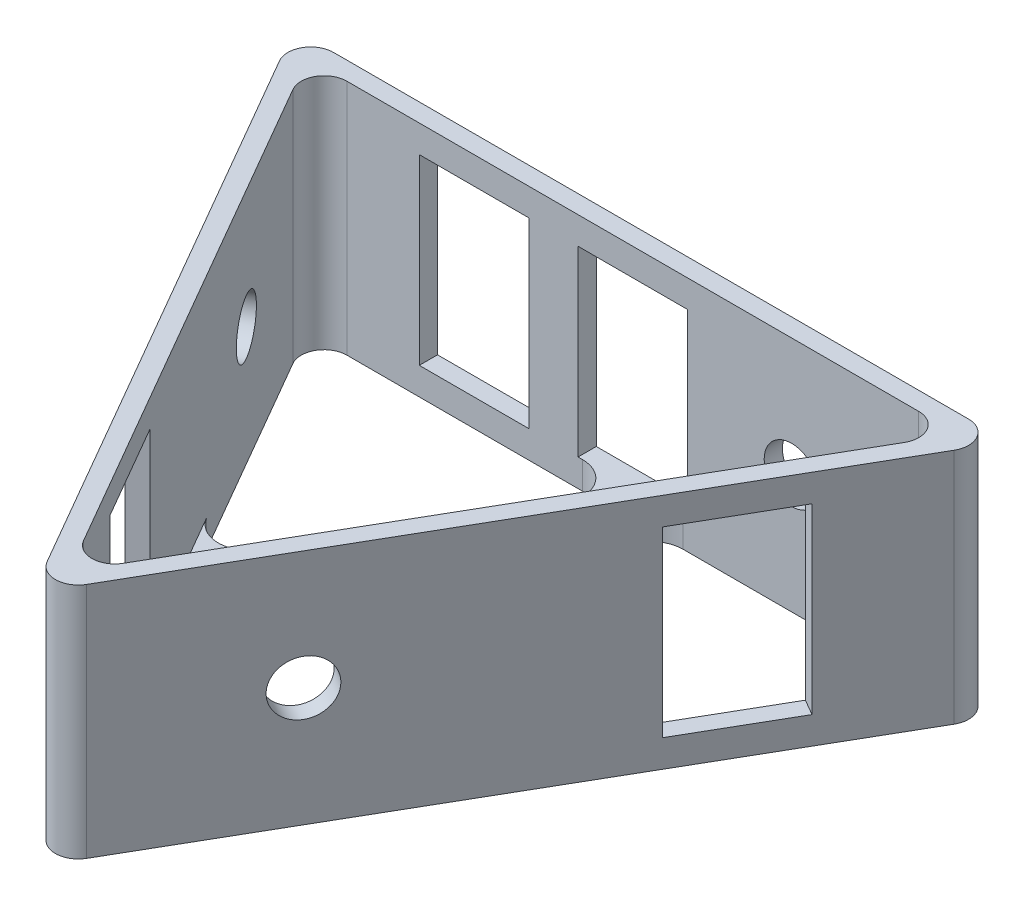
from build123d import *

# Parameters (mm, degrees)
BOSS_EXTRUDE1_DEPTH = 26
FILLET1_R           = 2.5
CUT_EXTRUDE1_REACH  = 76.051
SKETCH2_R           = 3
CUT_EXTRUDE2_REACH  = 73.261
SKETCH3_R           = 3
CUT_EXTRUDE3_REACH  = 90.154
SKETCH4_R           = 3
SKETCH4_W           = 12
SKETCH4_H           = 20
BOSS_EXTRUDE2_DEPTH = 3
FILLET2_R           = 3.5


with BuildPart() as part:
    # Sketch1 → Boss-Extrude1 (new body)
    with BuildSketch(Plane(origin=(0, 0, 0), x_dir=(1, 0, 0), z_dir=(0, 1, 0))):
        Polygon((-55.080799194, 36.198206666), (23.167912006, 36.198206666), (-15.956443594, -31.567165046), align=None)
        Polygon((-51.616697579, 34.198206666), (19.703810391, 34.198206666), (-15.956443594, -27.567165046), align=None, mode=Mode.SUBTRACT)
    extrude(amount=BOSS_EXTRUDE1_DEPTH)

    # Fillet1
    fillet1_edges = [part.edges().sort_by_distance(p)[0] for p in [
        (-51.616697579, 13, -34.198206666),
        (-15.956443594, 13, 27.567165046),
        (19.703810391, 13, -34.198206666),
        (-55.080799194, 13, -36.198206666),
        (23.167912006, 13, -36.198206666),
        (-15.956443594, 13, 31.567165046),
    ]]
    fillet(fillet1_edges, radius=FILLET1_R)

    # Sketch2 → Cut-Extrude1 (cut, up to next)
    with BuildSketch(Plane(origin=(-25.636316123, 0, 14.801134015), x_dir=(0.49999999999999806, 0, 0.8660254037844397), z_dir=(-0.8660254037844397, 0, 0.49999999999999806)), mode=Mode.PRIVATE) as cut_extrude1_sk1:
        Polygon((3.632503749, 4.258248906), (-8.367496251, 8.741751094), (-8.367496251, 3), (3.632503749, 3), align=None)
    cut_extrude1_tool1 = extrude(cut_extrude1_sk1.sketch, amount=-CUT_EXTRUDE1_REACH, mode=Mode.PRIVATE) & part.part
    # Sketch2 → Cut-Extrude1 (cut, up to next)
    with BuildSketch(Plane(origin=(-25.636316123, 0, 14.801134015), x_dir=(0.49999999999999806, 0, 0.8660254037844397), z_dir=(-0.8660254037844397, 0, 0.49999999999999806)), mode=Mode.PRIVATE) as cut_extrude1_sk2:
        Polygon((-8.367496251, 13), (-8.367496251, 8.741751094), (3.632503749, 4.258248906), (3.632503749, 13), align=None)
    cut_extrude1_tool2 = extrude(cut_extrude1_sk2.sketch, amount=-CUT_EXTRUDE1_REACH, mode=Mode.PRIVATE) & part.part
    # Sketch2 → Cut-Extrude1 (cut, up to next)
    with BuildSketch(Plane(origin=(-25.636316123, 0, 14.801134015), x_dir=(0.49999999999999806, 0, 0.8660254037844397), z_dir=(-0.8660254037844397, 0, 0.49999999999999806)), mode=Mode.PRIVATE) as cut_extrude1_sk3:
        Polygon((3.632503749, 21.741751094), (-8.367496251, 17.258248906), (-8.367496251, 13), (3.632503749, 13), align=None)
    cut_extrude1_tool3 = extrude(cut_extrude1_sk3.sketch, amount=-CUT_EXTRUDE1_REACH, mode=Mode.PRIVATE) & part.part
    # Sketch2 → Cut-Extrude1 (cut, up to next)
    with BuildSketch(Plane(origin=(-25.636316123, 0, 14.801134015), x_dir=(0.49999999999999806, 0, 0.8660254037844397), z_dir=(-0.8660254037844397, 0, 0.49999999999999806)), mode=Mode.PRIVATE) as cut_extrude1_sk4:
        Polygon((-8.367496251, 23), (-8.367496251, 17.258248906), (3.632503749, 21.741751094), (3.632503749, 23), align=None)
    cut_extrude1_tool4 = extrude(cut_extrude1_sk4.sketch, amount=-CUT_EXTRUDE1_REACH, mode=Mode.PRIVATE) & part.part
    # Sketch2 → Cut-Extrude1 (cut, up to next)
    with BuildSketch(Plane(origin=(-25.636316123, 0, 14.801134015), x_dir=(0.49999999999999806, 0, 0.8660254037844397), z_dir=(-0.8660254037844397, 0, 0.49999999999999806)), mode=Mode.PRIVATE) as cut_extrude1_sk5:
        with Locations((-37.161724832, 13)):
            Circle(SKETCH2_R)
    cut_extrude1_tool5 = extrude(cut_extrude1_sk5.sketch, amount=-CUT_EXTRUDE1_REACH, mode=Mode.PRIVATE) & part.part
    add(cut_extrude1_tool1.solids().sort_by_distance((-27.460565, 4.989307, 11.641443))[0], mode=Mode.SUBTRACT)
    add(cut_extrude1_tool2.solids().sort_by_distance((-26.475179, 9.621142, 13.34818))[0], mode=Mode.SUBTRACT)
    add(cut_extrude1_tool3.solids().sort_by_distance((-26.475179, 16.378858, 13.34818))[0], mode=Mode.SUBTRACT)
    add(cut_extrude1_tool4.solids().sort_by_distance((-27.460565, 21.010693, 11.641443))[0], mode=Mode.SUBTRACT)
    add(cut_extrude1_tool5.solids().sort_by_distance((-44.217179, 13, -17.381864))[0], mode=Mode.SUBTRACT)

    # Sketch3 → Cut-Extrude2 (cut, up to next)
    with BuildSketch(Plane(origin=(1.701650732, 0, 0.982448508), x_dir=(0.5000000000000041, 0, -0.8660254037844364), z_dir=(0.8660254037844364, 0, 0.5000000000000041)), mode=Mode.PRIVATE) as cut_extrude2_sk1:
        Polygon((15.205281238, 13), (15.205281238, 8.741751094), (27.205281238, 4.258248906), (27.205281238, 13), align=None)
    cut_extrude2_tool1 = extrude(cut_extrude2_sk1.sketch, amount=-CUT_EXTRUDE2_REACH, mode=Mode.PRIVATE) & part.part
    # Sketch3 → Cut-Extrude2 (cut, up to next)
    with BuildSketch(Plane(origin=(1.701650732, 0, 0.982448508), x_dir=(0.5000000000000041, 0, -0.8660254037844364), z_dir=(0.8660254037844364, 0, 0.5000000000000041)), mode=Mode.PRIVATE) as cut_extrude2_sk2:
        Polygon((27.205281238, 4.258248906), (15.205281238, 8.741751094), (15.205281238, 3), (27.205281238, 3), align=None)
    cut_extrude2_tool2 = extrude(cut_extrude2_sk2.sketch, amount=-CUT_EXTRUDE2_REACH, mode=Mode.PRIVATE) & part.part
    # Sketch3 → Cut-Extrude2 (cut, up to next)
    with BuildSketch(Plane(origin=(1.701650732, 0, 0.982448508), x_dir=(0.5000000000000041, 0, -0.8660254037844364), z_dir=(0.8660254037844364, 0, 0.5000000000000041)), mode=Mode.PRIVATE) as cut_extrude2_sk3:
        Polygon((27.205281238, 21.741751094), (15.205281238, 17.258248906), (15.205281238, 13), (27.205281238, 13), align=None)
    cut_extrude2_tool3 = extrude(cut_extrude2_sk3.sketch, amount=-CUT_EXTRUDE2_REACH, mode=Mode.PRIVATE) & part.part
    # Sketch3 → Cut-Extrude2 (cut, up to next)
    with BuildSketch(Plane(origin=(1.701650732, 0, 0.982448508), x_dir=(0.5000000000000041, 0, -0.8660254037844364), z_dir=(0.8660254037844364, 0, 0.5000000000000041)), mode=Mode.PRIVATE) as cut_extrude2_sk4:
        Polygon((15.205281238, 23), (15.205281238, 17.258248906), (27.205281238, 21.741751094), (27.205281238, 23), align=None)
    cut_extrude2_tool4 = extrude(cut_extrude2_sk4.sketch, amount=-CUT_EXTRUDE2_REACH, mode=Mode.PRIVATE) & part.part
    # Sketch3 → Cut-Extrude2 (cut, up to next)
    with BuildSketch(Plane(origin=(1.701650732, 0, 0.982448508), x_dir=(0.5000000000000041, 0, -0.8660254037844364), z_dir=(0.8660254037844364, 0, 0.5000000000000041)), mode=Mode.PRIVATE) as cut_extrude2_sk5:
        with Locations((-13.588947343, 13)):
            Circle(SKETCH3_R)
    cut_extrude2_tool5 = extrude(cut_extrude2_sk5.sketch, amount=-CUT_EXTRUDE2_REACH, mode=Mode.PRIVATE) & part.part
    add(cut_extrude2_tool1.solids().sort_by_distance((12.649176, 9.621142, -17.979222))[0], mode=Mode.SUBTRACT)
    add(cut_extrude2_tool2.solids().sort_by_distance((11.663791, 4.989307, -16.272485))[0], mode=Mode.SUBTRACT)
    add(cut_extrude2_tool3.solids().sort_by_distance((12.649176, 16.378858, -17.979222))[0], mode=Mode.SUBTRACT)
    add(cut_extrude2_tool4.solids().sort_by_distance((11.663791, 21.010693, -16.272485))[0], mode=Mode.SUBTRACT)
    add(cut_extrude2_tool5.solids().sort_by_distance((-5.092823, 13, 12.750822))[0], mode=Mode.SUBTRACT)

    # Sketch4 → Cut-Extrude3 (cut, up to next)
    with BuildSketch(Plane(origin=(0, 0, -36.198206666), x_dir=(-1, 0, 0), z_dir=(0, 0, -1)), mode=Mode.PRIVATE) as cut_extrude3_sk1:
        with Locations((-1.440670696, 13)):
            Circle(SKETCH4_R)
    cut_extrude3_tool1 = extrude(cut_extrude3_sk1.sketch, amount=-CUT_EXTRUDE3_REACH, mode=Mode.PRIVATE) & part.part
    # Sketch4 → Cut-Extrude3 (cut, up to next)
    with BuildSketch(Plane(origin=(0, 0, -36.198206666), x_dir=(-1, 0, 0), z_dir=(0, 0, -1)), mode=Mode.PRIVATE) as cut_extrude3_sk2:
        with Locations((15.956443594, 13)):
            Rectangle(SKETCH4_W, SKETCH4_H)
    cut_extrude3_tool2 = extrude(cut_extrude3_sk2.sketch, amount=-CUT_EXTRUDE3_REACH, mode=Mode.PRIVATE) & part.part
    # Sketch4 → Cut-Extrude3 (cut, up to next)
    with BuildSketch(Plane(origin=(0, 0, -36.198206666), x_dir=(-1, 0, 0), z_dir=(0, 0, -1)), mode=Mode.PRIVATE) as cut_extrude3_sk3:
        with Locations((33.353557885, 13)):
            Rectangle(SKETCH4_W, SKETCH4_H)
    cut_extrude3_tool3 = extrude(cut_extrude3_sk3.sketch, amount=-CUT_EXTRUDE3_REACH, mode=Mode.PRIVATE) & part.part
    add(cut_extrude3_tool1.solids().sort_by_distance((1.440671, 13, -36.198207))[0], mode=Mode.SUBTRACT)
    add(cut_extrude3_tool2.solids().sort_by_distance((-15.956444, 13, -36.198207))[0], mode=Mode.SUBTRACT)
    add(cut_extrude3_tool3.solids().sort_by_distance((-33.353558, 13, -36.198207))[0], mode=Mode.SUBTRACT)

    # Sketch5 → Boss-Extrude2 (add)
    with BuildSketch(Plane.XZ):
        with BuildLine():
            Line((-17.038975349, -12.984749429), (-33.786570587, -3.31552081))
            Line((-33.786570587, -3.31552081), (-34.786570587, -5.047571617))
            Line((-34.786570587, -5.047571617), (-17.956443594, -14.764449967))
            Line((-17.956443594, -14.764449967), (-17.956443594, -34.198206666))
            Line((-17.956443594, -34.198206666), (-15.956443594, -34.198206666))
            Line((-15.956443594, -34.198206666), (-15.956443594, -14.859749429))
            ThreePointArc((-15.956443594, -14.859749429), (-17.038975349, -14.234749429), (-17.038975349, -12.984749429))
        make_face()
        with BuildLine():
            Line((-32.786570587, -1.583470002), (-33.786570587, -3.31552081))
            Line((-33.786570587, -3.31552081), (-17.038975349, -12.984749429))
            ThreePointArc((-17.038975349, -12.984749429), (-15.956443594, -12.359749429), (-14.873911839, -12.984749429))
            Line((-14.873911839, -12.984749429), (1.873683398, -3.31552081))
            Line((1.873683398, -3.31552081), (0.873683398, -1.583470002))
            Line((0.873683398, -1.583470002), (-15.956443594, -11.300348352))
            Line((-15.956443594, -11.300348352), (-32.786570587, -1.583470002))
        make_face()
        with BuildLine():
            Line((1.873683398, -3.31552081), (-14.873911839, -12.984749429))
            ThreePointArc((-14.873911839, -12.984749429), (-14.749036311, -13.286225622), (-14.706443594, -13.609749429))
            ThreePointArc((-14.706443594, -13.609749429), (-15.072560118, -14.493632905), (-15.956443594, -14.859749429))
            Line((-15.956443594, -14.859749429), (-15.956443594, -34.198206666))
            Line((-15.956443594, -34.198206666), (-13.956443594, -34.198206666))
            Line((-13.956443594, -34.198206666), (-13.956443594, -14.764449967))
            Line((-13.956443594, -14.764449967), (2.873683398, -5.047571617))
            Line((2.873683398, -5.047571617), (1.873683398, -3.31552081))
        make_face()
    extrude(amount=-BOSS_EXTRUDE2_DEPTH)

    # Fillet2
    fillet2_edges = [part.edges().sort_by_distance(p)[0] for p in [
        (0.873683398, 1.5, -1.583470002),
        (2.873683398, 1.5, -5.047571617),
        (-13.956443594, 1.5, -14.764449967),
        (-13.956443594, 1.5, -34.198206666),
        (-17.956443594, 1.5, -34.198206666),
        (-17.956443594, 1.5, -14.764449967),
        (-34.786570587, 1.5, -5.047571617),
        (-32.786570587, 1.5, -1.583470002),
        (-15.956443594, 1.5, -11.300348352),
    ]]
    fillet(fillet2_edges, radius=FILLET2_R)


solid = part.part
